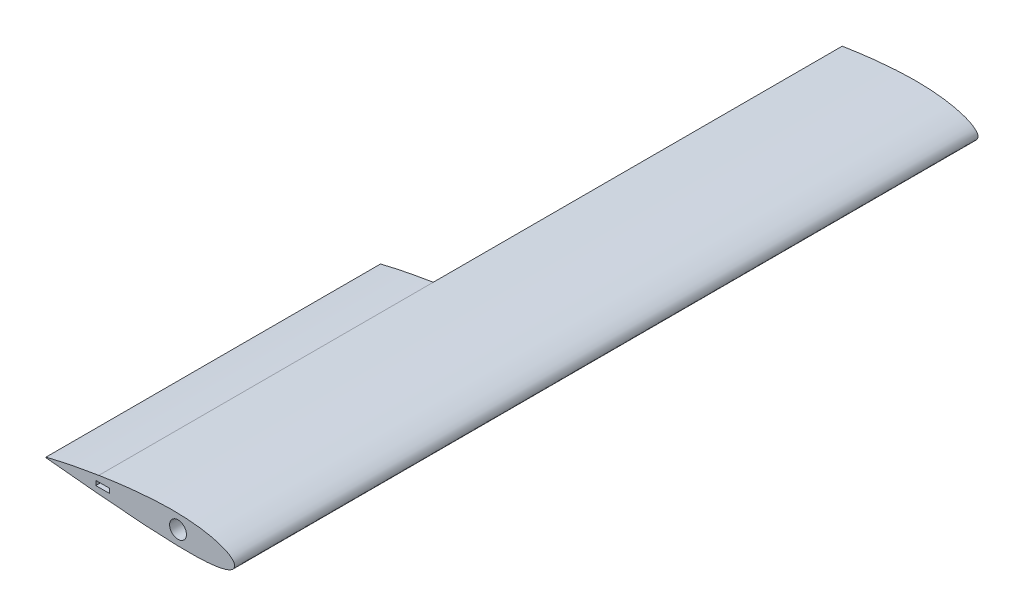
from build123d import *

# Parameters (mm, degrees)
BOSS_EXTRUDE1_DEPTH = 1120
BOSS_EXTRUDE2_DEPTH = 504
SKETCH3_R           = 12.7
CUT_EXTRUDE1_DEPTH  = 801
SKETCH4_W           = 32
SKETCH4_H           = 38.019
CUT_EXTRUDE2_DEPTH  = 46
SKETCH5_W           = 60
SKETCH5_H           = 12
CUT_EXTRUDE3_DEPTH  = 46
SKETCH6_W           = 54
SKETCH6_H           = 29.1
CUT_EXTRUDE4_DEPTH  = 64
SKETCH7_W           = 20.4
SKETCH7_H           = 6.8
CUT_EXTRUDE5_DEPTH  = 26
SKETCH8_W           = 20
SKETCH8_H           = 4
CUT_EXTRUDE6_DEPTH  = 20


with BuildPart() as part:
    # Sketch1 → Boss-Extrude1 (new body)
    with BuildSketch(Plane.XY):
        with BuildLine():
            Line((-204.60672, 16.43373442), (-204.60672, -8.19868247))
            add(Edge.make_bspline(
                [(-204.60672, 16.43373442), (-202.036361523, 16.843517491), (-195.976847624, 17.809564148), (-186.31991623, 19.219612694), (-175.572173627, 20.681898456), (-164.607311335, 22.038583826), (-153.49404645, 23.271644216), (-142.301458132, 24.357624452), (-131.099746315, 25.27611377), (-119.943510485, 26.006687445), (-108.882401137, 26.537168758), (-97.984658952, 26.784601367), (-87.339197239, 26.746452246), (-77.037775283, 26.416865966), (-67.149643376, 25.798512435), (-57.741129063, 24.898884792), (-48.874997943, 23.731117117), (-40.609751299, 22.313467309), (-32.99899187, 20.668813467), (-26.09083036, 18.823819721), (-19.927325542, 16.807846118), (-14.543890216, 14.651588692), (-9.968619512, 12.385203852), (-6.221379001, 10.035790246), (-3.313738727, 7.621930176), (-1.252844721, 5.146672973), (-0.067461683, 2.586657871), (0.154594698, -0.015527038), (-0.577602024, -2.520166193), (-2.23111232, -4.795683741), (-4.705066866, -6.827199984), (-7.969820634, -8.652738302), (-12.011996138, -10.283908092), (-16.812796605, -11.721159399), (-22.346009478, -12.960758117), (-28.579355048, -13.999351597), (-35.475903212, -14.835557319), (-42.995015776, -15.470938778), (-51.09296977, -15.910485811), (-59.723361484, -16.162845606), (-68.837366971, -16.240282897), (-78.383909857, -16.158476575), (-88.309752455, -15.935832899), (-98.559621371, -15.593680374), (-109.096656126, -15.151303304), (-119.877295693, -14.638508478), (-130.835253322, -14.00930548), (-141.884466391, -13.29005991), (-152.942439018, -12.499573468), (-163.942262105, -11.656685653), (-174.816986108, -10.778505542), (-185.49994365, -9.879627403), (-195.408852603, -9.021145417), (-201.74858929, -8.4542533), (-204.60672, -8.19868247)],
                knots=[0, 0, 0, 0, 0.018424224, 0.043434346, 0.069080412, 0.095203092, 0.121640117, 0.148227444, 0.17480049, 0.201195447, 0.227363977, 0.253181792, 0.278347264, 0.302710399, 0.326128333, 0.348466602, 0.369600377, 0.389415723, 0.407811011, 0.424698681, 0.44000774, 0.453687637, 0.465714725, 0.476103672, 0.484928355, 0.492360154, 0.498730164, 0.504586951, 0.510443348, 0.516803825, 0.524198712, 0.532940661, 0.543185695, 0.554995644, 0.568376342, 0.583298542, 0.599709376, 0.617538825, 0.636703502, 0.65710892, 0.678650912, 0.701216586, 0.724685048, 0.748928058, 0.7738107, 0.799337901, 0.825325561, 0.851504471, 0.877716004, 0.903800001, 0.929595993, 0.954944401, 0.979687675, 1, 1, 1, 1], degree=3))
        make_face()
    extrude(amount=-BOSS_EXTRUDE1_DEPTH)

    # Sketch2 → Boss-Extrude2 (add)
    with BuildSketch(Plane.XY):
        with BuildLine():
            Line((-204.60672, 16.43373442), (-204.60672, -8.19868247))
            add(Edge.make_bspline(
                [(-204.60672, -8.19868247), (-205.123341506, -8.152765503), (-208.886818398, -7.818270242), (-215.747067479, -7.19031909), (-225.019618317, -6.332407693), (-233.78771967, -5.505552256), (-241.996048886, -4.719294865), (-249.592303574, -3.980104608), (-256.527861477, -3.294772313), (-262.75808282, -2.6700791), (-268.242600782, -2.111780911), (-272.945834404, -1.62819317), (-276.836698489, -1.219072845), (-279.890503934, -0.906023665), (-282.084971372, -0.653321358), (-283.409976301, -0.546659805), (-284.007600869, -0.445986487), (-284.166073983, -0.446550556), (-284.176, -0.446585887)],
                knots=[0, 0, 0, 0, 0.019462551, 0.14178051, 0.258505433, 0.368899529, 0.472261554, 0.567931303, 0.655293986, 0.733784513, 0.802891701, 0.862162346, 0.911205133, 0.949694244, 0.977372582, 0.994054454, 0.999627599, 1, 1, 1, 1], degree=3))
            Line((-284.176, -0.446585887), (-284.176, 0.453857008))
            add(Edge.make_bspline(
                [(-204.60672, 16.43373442), (-205.415471282, 16.307052878), (-209.473007674, 15.671486692), (-216.612776575, 14.457484774), (-225.855570238, 12.827283141), (-234.573734516, 11.204003783), (-242.71639827, 9.620137001), (-250.234645079, 8.09672624), (-257.084002847, 6.657250954), (-263.224123157, 5.323917782), (-268.619097463, 4.118109632), (-273.237578469, 3.059759971), (-277.052897898, 2.166891113), (-280.043162129, 1.455156879), (-282.19127614, 0.937226778), (-283.475130043, 0.62509225), (-284.041595768, 0.4866944), (-284.176, 0.453857008)],
                knots=[0, 0, 0, 0, 0.030251696, 0.151773928, 0.267626296, 0.377089872, 0.479484952, 0.574174897, 0.660569789, 0.738129949, 0.806369318, 0.864858701, 0.913228834, 0.951173208, 0.978450569, 0.994887008, 1, 1, 1, 1], degree=3))
        make_face()
    extrude(amount=-BOSS_EXTRUDE2_DEPTH)

    # Sketch3 → Cut-Extrude1 (cut)
    with BuildSketch(Plane.XY):
        with Locations((-85.253, 5.328)):
            Circle(SKETCH3_R)
    extrude(amount=-CUT_EXTRUDE1_DEPTH, mode=Mode.SUBTRACT)

    # Sketch4 → Cut-Extrude2 (cut)
    with BuildSketch(Plane.XY.offset(-376.7)):
        with Locations((-85.253, 2.0185)):
            Rectangle(SKETCH4_W, SKETCH4_H)
    extrude(amount=CUT_EXTRUDE2_DEPTH, mode=Mode.SUBTRACT)

    # Sketch5 → Cut-Extrude3 (cut)
    with BuildSketch(Plane.XY.offset(-376.7)):
        with Locations((-227.3408, -2.16)):
            Rectangle(SKETCH5_W, SKETCH5_H)
    extrude(amount=CUT_EXTRUDE3_DEPTH, mode=Mode.SUBTRACT)

    # Sketch6 → Cut-Extrude4 (cut)
    with BuildSketch(Plane.XY.offset(-598.5)):
        with Locations((-156.297, -0.714)):
            Rectangle(SKETCH6_W, SKETCH6_H)
    extrude(amount=CUT_EXTRUDE4_DEPTH, mode=Mode.SUBTRACT)

    # Sketch7 → Cut-Extrude5 (cut)
    with BuildSketch(Plane.XY.offset(-25.5)):
        with Locations((-198.923, 4.263)):
            Rectangle(SKETCH7_W, SKETCH7_H)
    extrude(amount=CUT_EXTRUDE5_DEPTH, mode=Mode.SUBTRACT)

    # Sketch8 → Cut-Extrude6 (cut)
    with BuildSketch(Plane.XY.offset(-930)):
        with Locations((-50, -15.172)):
            Rectangle(SKETCH8_W, SKETCH8_H)
    extrude(amount=CUT_EXTRUDE6_DEPTH, mode=Mode.SUBTRACT)


solid = part.part
